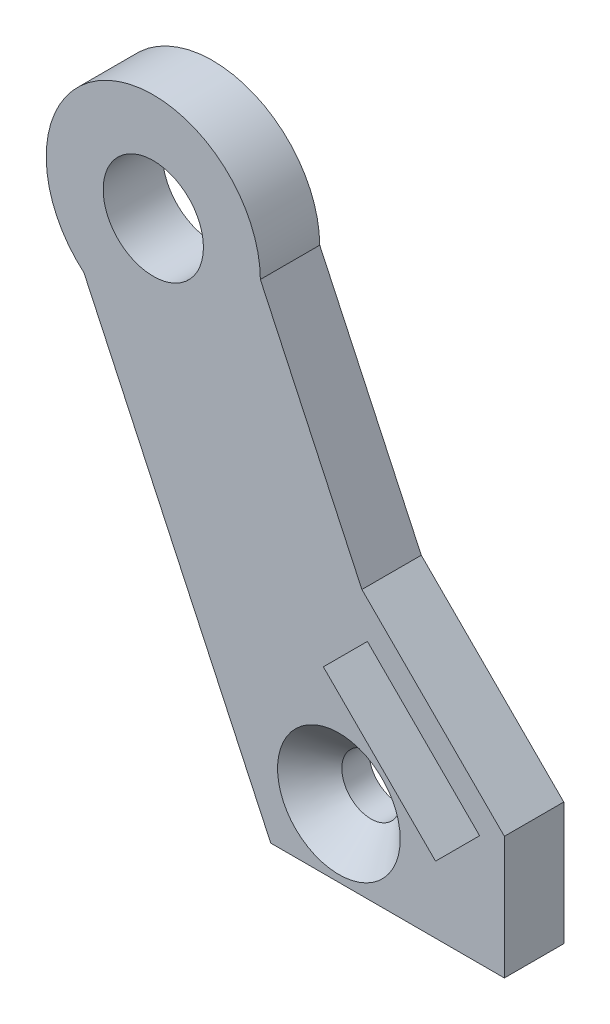
from build123d import *

# Parameters (mm, degrees)
SKETCH1_R           = 2.575
BOSS_EXTRUDE1_DEPTH = 3.05


with BuildPart() as part:
    # Sketch1 → Boss-Extrude1 (new body)
    with BuildSketch(Plane.XY):
        with BuildLine():
            Line((0, 0), (12, 0))
            Line((12, 0), (12, 6.303908615))
            Line((12, 6.303908615), (4.681585686, 13.62232293))
            Line((4.681585686, 13.62232293), (-0.534038586, 24.807265275))
            ThreePointArc((-0.534038586, 24.807265275), (-8.358318048, 29.755478813), (-9.597116456, 20.581082657))
            Line((-9.597116456, 20.581082657), (0, 0))
        make_face()
        Polygon((10.727207794, 5.692209589), (8.464466094, 3.429467889), (2.701545827, 9.192388155), (4.964287527, 11.455129855), align=None, mode=Mode.SUBTRACT)
        with BuildLine():
            ThreePointArc((2, 3.5), (4.560660172, 4.560660172), (3.5, 2))
            Line((3.5, 2), (3.5, 3.5))
            Line((3.5, 3.5), (2, 3.5))
        make_face(mode=Mode.SUBTRACT)
        with Locations((-6.033917608, 24.770785985)):
            Circle(SKETCH1_R, mode=Mode.SUBTRACT)
    extrude(amount=BOSS_EXTRUDE1_DEPTH)

    # Sketch3 → CSK for M3 Flat Head Machine Screw1 (revolve, cut)
    with BuildSketch(Plane(origin=(3.5, 3.5, 3.05), x_dir=(0, -1, 0), z_dir=(1, 0, 0))):
        Polygon((0, 0), (0, 3.05), (1.5, 3.05), (1.5, 1.65), (3.15, 0), align=None)
    revolve(axis=Axis((3.5, 3.5, 9.4), (0, 0, -1)), mode=Mode.SUBTRACT)


solid = part.part
